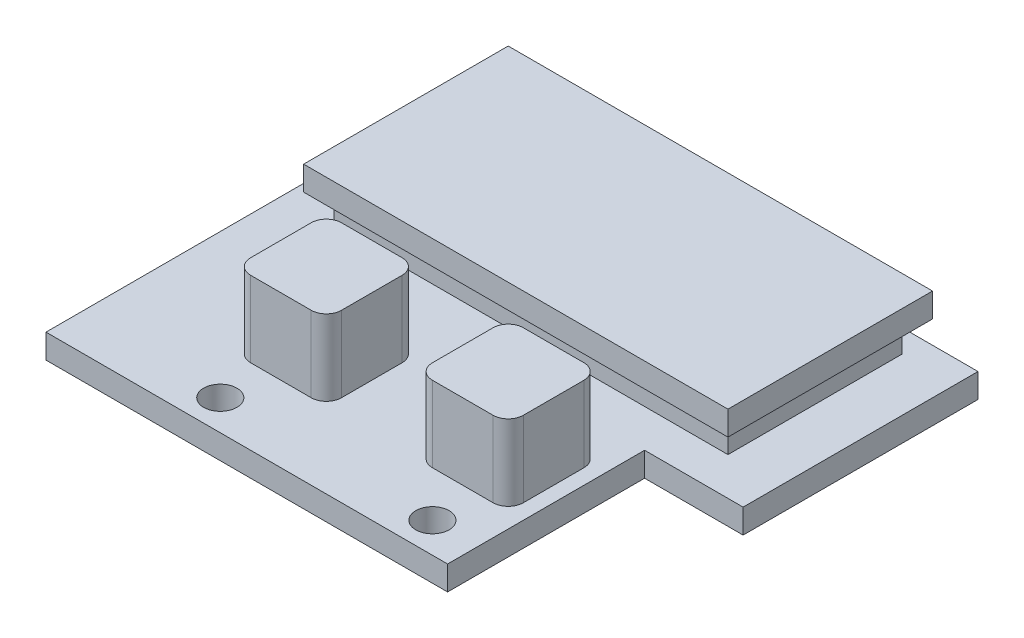
from build123d import *

# Parameters (mm, degrees)
EXTRUDE_1_DEPTH     = 1.6
SKETCH_4_W          = 3
SKETCH_4_H          = 6.75
EXTRUDE_2_DEPTH     = 1.7
SKETCH_5_R          = 1.1
CUT_EXTRUDE_1_DEPTH = 22.867841686
SKETCH_6_W          = 6
SKETCH_6_H          = 6
EXTRUDE_3_DEPTH     = 5
FILLET_1_R          = 1
EXTRUDE_START       = 2
SKETCH_7_W          = 28
SKETCH_7_H          = 13.5
EXTRUDE_4_DEPTH     = 1.6
SKETCH_8_W          = 26
SKETCH_8_H          = 11.5
EXTRUDE_5_DEPTH     = 2


with BuildPart() as part:
    # 草图1 → 凸台-拉伸1 (new body)
    with BuildSketch(Plane(origin=(0, 0, 0), x_dir=(1, 0, 0), z_dir=(0, 1, 0))):
        Polygon((16.5, -1.25), (10, -1.25), (10, -14.25), (-16.5, -14.25), (-16.5, 14.25), (16.5, 14.25), align=None)
    extrude(amount=EXTRUDE_1_DEPTH)

    # 草图4 → 凸台-拉伸2 (add)
    with BuildSketch(Plane.XZ):
        with Locations((-10, -9.375)):
            Rectangle(SKETCH_4_W, SKETCH_4_H)
        with Locations((10, -9.375)):
            Rectangle(SKETCH_4_W, SKETCH_4_H)
    extrude(amount=EXTRUDE_2_DEPTH)

    # 草图5 → 切除-拉伸1 (cut, through all)
    with BuildSketch(Plane(origin=(0, 0, 0), x_dir=(-1, 0, 0), z_dir=(0, -1, 0))):
        with Locations(Location((7, -12.25, 0), (0, 0, 90))):
            Circle(SKETCH_5_R)
        with Locations(Location((-7, -12.25, 0), (0, 0, 270))):
            Circle(SKETCH_5_R)
    extrude(amount=-CUT_EXTRUDE_1_DEPTH, mode=Mode.SUBTRACT)

    # 草图6 → 凸台-拉伸3 (add)
    with BuildSketch(Plane(origin=(0, 1.6, 0), x_dir=(1, 0, 0), z_dir=(0, 1, 0))):
        with Locations((6, -6.25)):
            Rectangle(SKETCH_6_W, SKETCH_6_H)
        with Locations((-6, -6.25)):
            Rectangle(SKETCH_6_W, SKETCH_6_H)
    extrude(amount=EXTRUDE_3_DEPTH)

    # 圆角1
    fillet_1_edges = [part.edges().sort_by_distance(p)[0] for p in [
        (3, 4.1, 3.25),
        (3, 4.1, 9.25),
        (9, 4.1, 9.25),
        (9, 4.1, 3.25),
        (-3, 4.1, 9.25),
        (-3, 4.1, 3.25),
        (-9, 4.1, 3.25),
        (-9, 4.1, 9.25),
    ]]
    fillet(fillet_1_edges, radius=FILLET_1_R)



with BuildPart() as body_2:
    # 草图7 → 凸台-拉伸4 (new body)
    with BuildSketch(Plane(origin=(0, 1.6, 0), x_dir=(1, 0, 0), z_dir=(0, 1, 0)).offset(EXTRUDE_START)):
        with Locations((0, 7)):
            Rectangle(SKETCH_7_W, SKETCH_7_H)
    extrude(amount=EXTRUDE_4_DEPTH)


with BuildPart() as part_1:
    add(part.part)

    add(body_2.part)  # 凸台-拉伸5 merges body 2
    # 草图8 → 凸台-拉伸5 (add)
    with BuildSketch(Plane(origin=(0, 1.6, 0), x_dir=(1, 0, 0), z_dir=(0, 1, 0))):
        with Locations((0, 7)):
            Rectangle(SKETCH_8_W, SKETCH_8_H)
    extrude(amount=EXTRUDE_5_DEPTH)


solid = part_1.part
